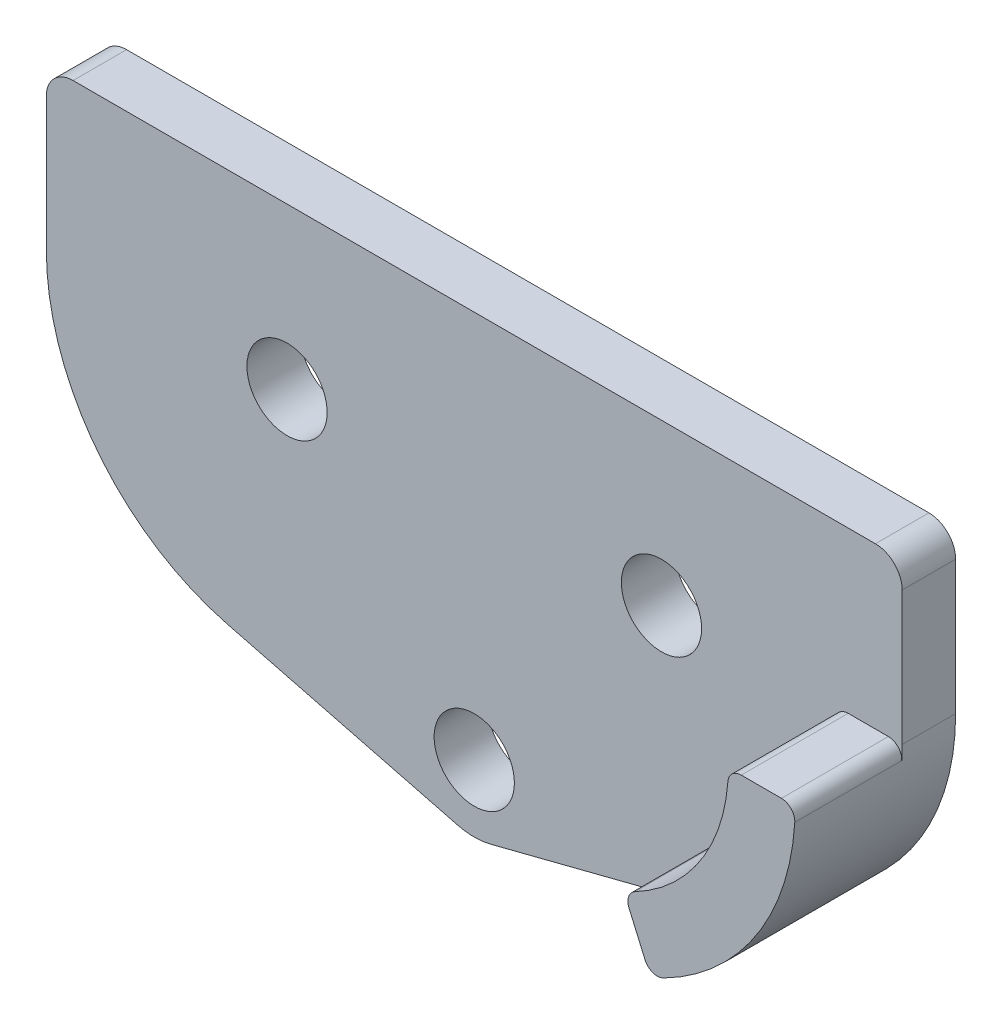
from build123d import *

# Parameters (mm, degrees)
SKETCH_2_R      = 1.5
EXTRUDE_1_DEPTH = 2
EXTRUDE_2_DEPTH = 4
FILLET_1_R      = 1
FILLET_4_R      = 0.5


with BuildPart() as part:
    # 草图2 → 凸台-拉伸1 (new body)
    with BuildSketch(Plane.XY):
        with BuildLine():
            Line((7, 6), (-7, 6))
            Line((-7, 6), (-16, 6))
            Line((-16, 6), (-16, 0))
            ThreePointArc((-16, 0), (-14.108952351, -5.519311231), (-9.230489674, -8.71922679))
            Line((-9.230489674, -8.71922679), (-0.619580465, -10.922007442))
            ThreePointArc((-0.619580465, -10.922007442), (0, -11), (0.619580465, -10.922007442))
            Line((0.619580465, -10.922007442), (9.230489674, -8.71922679))
            ThreePointArc((9.230489674, -8.71922679), (14.108952351, -5.519311231), (16, 0))
            Line((16, 0), (16, 6))
            Line((16, 6), (7, 6))
        make_face()
        with Locations((0, -8.5)):
            Circle(SKETCH_2_R, mode=Mode.SUBTRACT)
        with Locations((7, 0)):
            Circle(SKETCH_2_R, mode=Mode.SUBTRACT)
        with Locations(Location((-7, 0, 0), (0, 0, 180))):
            Circle(SKETCH_2_R, mode=Mode.SUBTRACT)
    extrude(amount=EXTRUDE_1_DEPTH)

    # 草图3 → 凸台-拉伸2 (add)
    with BuildSketch(Plane.XY.offset(2)):
        with BuildLine():
            Line((13.5, 0), (16, 0))
            ThreePointArc((16, 0), (14.527522767, -4.933193793), (10.591910889, -8.252161909))
            Line((10.591910889, -8.252161909), (9.594157864, -5.959894712))
            ThreePointArc((9.594157864, -5.959894712), (12.43654422, -3.562862184), (13.5, 0))
        make_face()
    extrude(amount=EXTRUDE_2_DEPTH)

    # 圆角1
    fillet_1_edges = [part.edges().sort_by_distance(p)[0] for p in [
        (-16, 6, 1),
        (16, 6, 1),
    ]]
    fillet(fillet_1_edges, radius=FILLET_1_R)

    # 圆角4
    fillet_4_edges = [part.edges().sort_by_distance(p)[0] for p in [
        (10.591910889, -8.252161909, 4),
        (16, 0, 4),
        (13.5, 0, 4),
        (9.594157864, -5.959894712, 4),
    ]]
    fillet(fillet_4_edges, radius=FILLET_4_R)


solid = part.part
